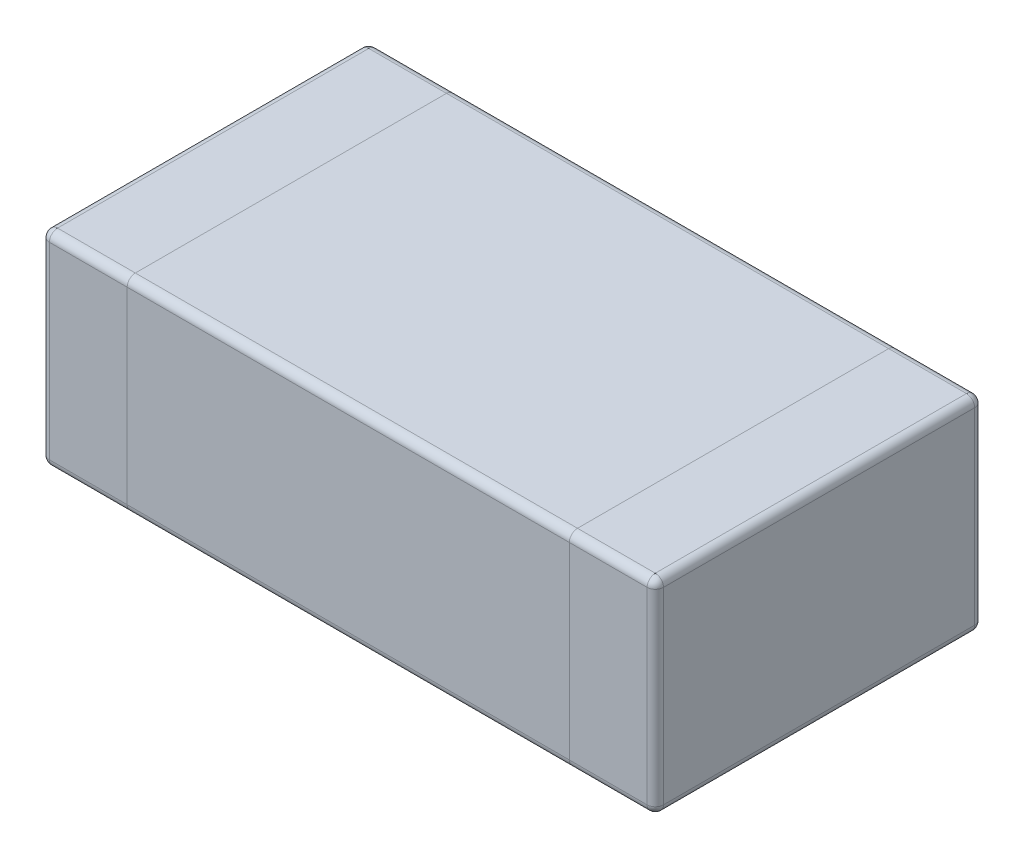
from build123d import *

# Parameters (mm, degrees)
BOSS_EXTRUDE1_DEPTH = 0.25
FILLET2_R           = 0.02


with BuildPart() as part:
    # Sketch1 → Boss-Extrude1 (new, symmetric)
    with BuildSketch(Plane(origin=(0, 0, 0), x_dir=(1, 0, 0), z_dir=(0, 1, 0))):
        with BuildLine():
            Line((-0.73, -0.4), (0.73, -0.4))
            ThreePointArc((0.73, -0.4), (0.744142136, -0.394142136), (0.75, -0.38))
            Line((0.75, -0.38), (0.75, 0.38))
            ThreePointArc((0.75, 0.38), (0.744142136, 0.394142136), (0.73, 0.4))
            Line((0.73, 0.4), (-0.73, 0.4))
            ThreePointArc((-0.73, 0.4), (-0.744142136, 0.394142136), (-0.75, 0.38))
            Line((-0.75, 0.38), (-0.75, -0.38))
            ThreePointArc((-0.75, -0.38), (-0.744142136, -0.394142136), (-0.73, -0.4))
        make_face()
    extrude(amount=BOSS_EXTRUDE1_DEPTH, both=True)

    # Fillet2
    fillet2_edges = [part.edges().sort_by_distance(p)[0] for p in [
        (0.744142136, 0.25, 0.394142136),
        (0, -0.25, 0.4),
        (-0.744142136, -0.25, 0.394142136),
        (0.75, 0.25, 0),
        (0.744142136, 0.25, -0.394142136),
        (0, 0.25, -0.4),
        (-0.744142136, 0.25, -0.394142136),
        (-0.75, 0.25, 0),
        (0, 0.25, 0.4),
        (0, 0.25, -0.4),
        (0, 0.25, -0.4),
        (0, 0.25, 0.4),
        (0, -0.25, 0.4),
        (0, -0.25, 0.4),
        (0, -0.25, -0.4),
        (0, -0.25, -0.4),
        (-0.744142136, 0.25, 0.394142136),
        (0, 0.25, 0.4),
        (-0.75, -0.25, 0),
        (-0.744142136, -0.25, -0.394142136),
        (0, -0.25, -0.4),
        (0.744142136, -0.25, -0.394142136),
        (0.75, -0.25, 0),
        (0.744142136, -0.25, 0.394142136),
    ]]
    fillet(fillet2_edges, radius=FILLET2_R)


solid = part.part
